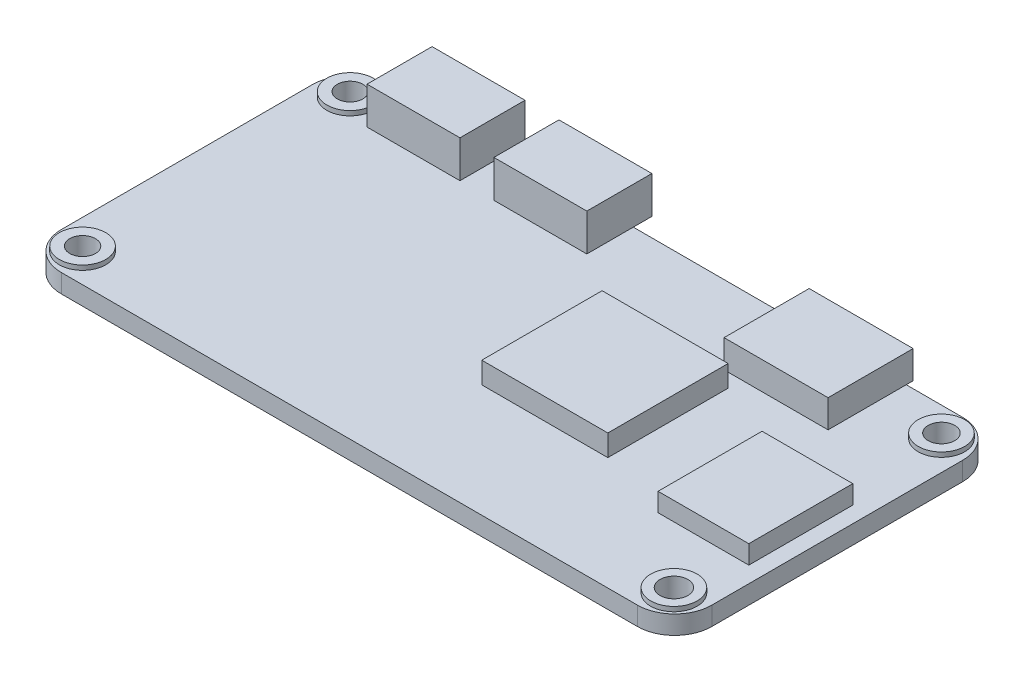
from build123d import *

# Parameters (mm, degrees)
BOSS_EXTRUDE1_DEPTH     = 2
SKETCH2_R               = 2.5
BOSS_EXTRUDE2_DEPTH     = 0.5
CUT_EXTRUDE1_DEPTH      = 40.182266397
CUT_EXTRUDE1_DEPTH_BACK = 40.182266397
SKETCH3_R               = 1.5
SKETCH3_R_2             = 1.3870402
SKETCH3_R_3             = 1.37388591
SKETCH3_R_4             = 1.428673318
SKETCH4_W               = 13.56544722
SKETCH4_H               = 12.948835983
BOSS_EXTRUDE3_DEPTH     = 2.3
SKETCH5_W               = 9.766151407
SKETCH5_H               = 11.19038182
BOSS_EXTRUDE4_DEPTH     = 2
SKETCH6_W               = 10
SKETCH6_H               = 7
BOSS_EXTRUDE5_DEPTH     = 4
SKETCH7_W               = 9.076584157
SKETCH7_H               = 3.089900989
SKETCH7_W_2             = 8.786905938
CUT_EXTRUDE2_DEPTH      = 5
SKETCH8_W               = 11.190381821
SKETCH8_H               = 9.155766944
BOSS_EXTRUDE6_DEPTH     = 3


with BuildPart() as part:
    # Sketch1 → Boss-Extrude1 (new body)
    with BuildSketch(Plane(origin=(0, 0, 0), x_dir=(1, 0, 0), z_dir=(0, 1, 0))):
        with BuildLine():
            Line((-31, 17.5), (31, 17.5))
            ThreePointArc((31, 17.5), (33.828427125, 16.328427125), (35, 13.5))
            Line((35, 13.5), (35, -13.5))
            ThreePointArc((35, -13.5), (33.828427125, -16.328427125), (31, -17.5))
            Line((31, -17.5), (-31, -17.5))
            ThreePointArc((-31, -17.5), (-33.828427125, -16.328427125), (-35, -13.5))
            Line((-35, -13.5), (-35, 13.5))
            ThreePointArc((-35, 13.5), (-33.828427125, 16.328427125), (-31, 17.5))
        make_face()
    extrude(amount=BOSS_EXTRUDE1_DEPTH)

    # Sketch2 → Boss-Extrude2 (add)
    with BuildSketch(Plane(origin=(0, 2, 0), x_dir=(1, 0, 0), z_dir=(0, 1, 0))):
        with Locations(Location((31.818181818, -14.393939394, 0), (0, 0, 270))):
            Circle(SKETCH2_R)
        with Locations(Location((-31.818181818, -14.393939394, 0), (0, 0, 270))):
            Circle(SKETCH2_R)
        with Locations(Location((-31.818181818, 14.393939394, 0), (0, 0, 270))):
            Circle(SKETCH2_R)
        with Locations(Location((31.818181818, 14.393939394, 0), (0, 0, 270))):
            Circle(SKETCH2_R)
    extrude(amount=BOSS_EXTRUDE2_DEPTH)

    # Sketch3 → Cut-Extrude1 (cut, two sides: drawn at the far end of the back side and taken through both)
    with BuildSketch(Plane(origin=(0, 2, 0), x_dir=(1, 0, 0), z_dir=(0, 1, 0)).offset(-CUT_EXTRUDE1_DEPTH_BACK)):
        with Locations(Location((31.818181818, -14.393939394, 0), (0, 0, 270))):
            Circle(SKETCH3_R)
        with Locations(Location((-31.818181818, -14.393939394, 0), (0, 0, 270))):
            Circle(SKETCH3_R_2)
        with Locations(Location((-31.818181818, 14.393939394, 0), (0, 0, 270))):
            Circle(SKETCH3_R_3)
        with Locations(Location((31.818181818, 14.393939394, 0), (0, 0, 270))):
            Circle(SKETCH3_R_4)
    extrude(amount=CUT_EXTRUDE1_DEPTH + CUT_EXTRUDE1_DEPTH_BACK, mode=Mode.SUBTRACT)

    # Sketch4 → Boss-Extrude3 (add)
    with BuildSketch(Plane(origin=(0, 2, 0), x_dir=(1, 0, 0), z_dir=(0, 1, 0))):
        with Locations((8.879537688, 1.123716819)):
            Rectangle(SKETCH4_W, SKETCH4_H)
    extrude(amount=BOSS_EXTRUDE3_DEPTH)

    # Sketch5 → Boss-Extrude4 (add)
    with BuildSketch(Plane(origin=(0, 2, 0), x_dir=(1, 0, 0), z_dir=(0, 1, 0))):
        with Locations((28.382877527, -2.187210992)):
            Rectangle(SKETCH5_W, SKETCH5_H)
    extrude(amount=BOSS_EXTRUDE4_DEPTH)

    # Sketch6 → Boss-Extrude5 (add)
    with BuildSketch(Plane(origin=(0, 2, 0), x_dir=(1, 0, 0), z_dir=(0, 1, 0))):
        with Locations((-9.446594787, 16)):
            Rectangle(SKETCH6_W, SKETCH6_H)
        with Locations((-23.101167125, 16)):
            Rectangle(SKETCH6_W, SKETCH6_H)
    extrude(amount=BOSS_EXTRUDE5_DEPTH)

    # Sketch7 → Cut-Extrude2 (cut)
    with BuildSketch(Plane(origin=(0, 0, -19.5), x_dir=(-1, 0, 0), z_dir=(0, 0, -1))):
        with Locations((9.33789674, 3.973358643)):
            Rectangle(SKETCH7_W, SKETCH7_H)
        with Locations((23.19417149, 3.973358643)):
            Rectangle(SKETCH7_W_2, SKETCH7_H)
    extrude(amount=-CUT_EXTRUDE2_DEPTH, mode=Mode.SUBTRACT)

    # Sketch8 → Boss-Extrude6 (add)
    with BuildSketch(Plane(origin=(0, 2, 0), x_dir=(1, 0, 0), z_dir=(0, 1, 0))):
        with Locations((19.328841327, 13.665477606)):
            Rectangle(SKETCH8_W, SKETCH8_H)
    extrude(amount=BOSS_EXTRUDE6_DEPTH)


solid = part.part
